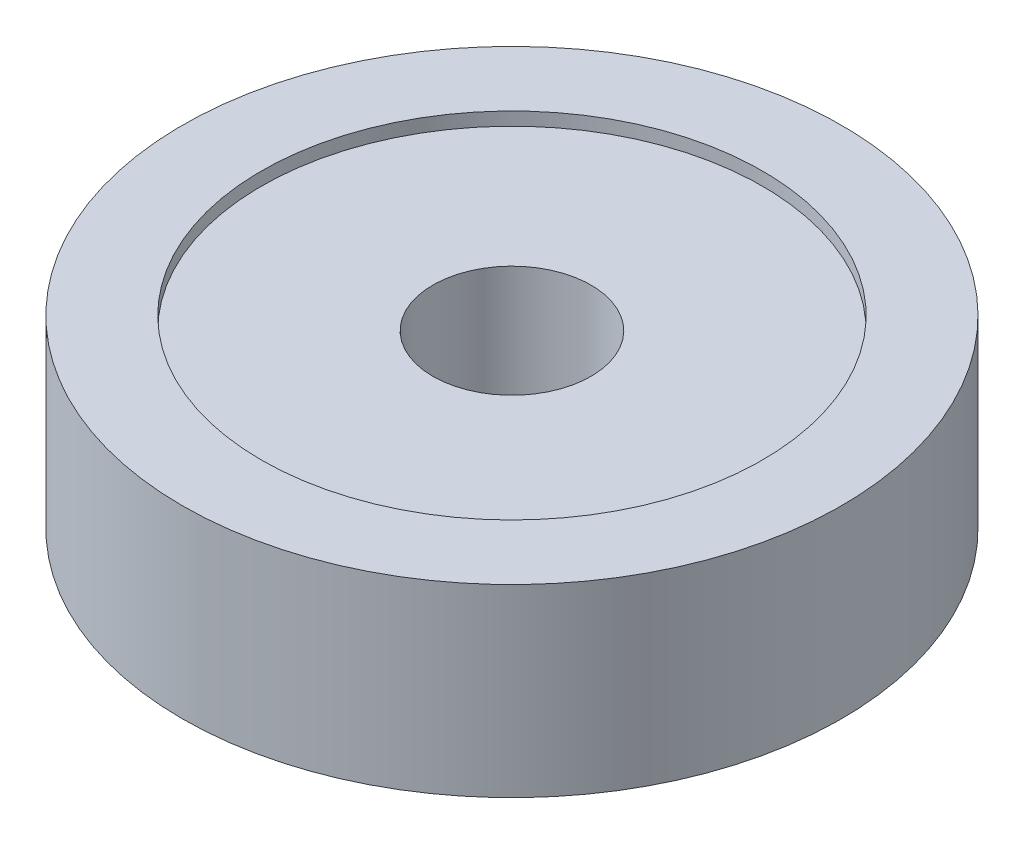
from build123d import *

# Parameters (mm, degrees)
SKETCH_1_R      = 9.5
SKETCH_1_R_2    = 3
EXTRUDE_1_DEPTH = 3
SKETCH_2_R      = 12.5
SKETCH_2_R_2    = 9.5
EXTRUDE_2_DEPTH = 3.5


with BuildPart() as part:
    # 草图1 → 凸台-拉伸1 (new, symmetric)
    with BuildSketch(Plane(origin=(0, 0, 0), x_dir=(1, 0, 0), z_dir=(0, 1, 0))):
        with Locations(Location((0, 0, 0), (0, 0, 270))):
            Circle(SKETCH_1_R)
        with Locations(Location((0, 0, 0), (0, 0, 270))):
            Circle(SKETCH_1_R_2, mode=Mode.SUBTRACT)
    extrude(amount=EXTRUDE_1_DEPTH, both=True)


with BuildPart() as body_2:
    # 草图2 → 凸台-拉伸2 (new, symmetric)
    with BuildSketch(Plane(origin=(0, 0, 0), x_dir=(1, 0, 0), z_dir=(0, 1, 0))):
        with Locations(Location((0, 0, 0), (0, 0, 270))):
            Circle(SKETCH_2_R)
        with Locations(Location((0, 0, 0), (0, 0, 270))):
            Circle(SKETCH_2_R_2, mode=Mode.SUBTRACT)
    extrude(amount=EXTRUDE_2_DEPTH, both=True)


solid = Compound([part.part, body_2.part])
